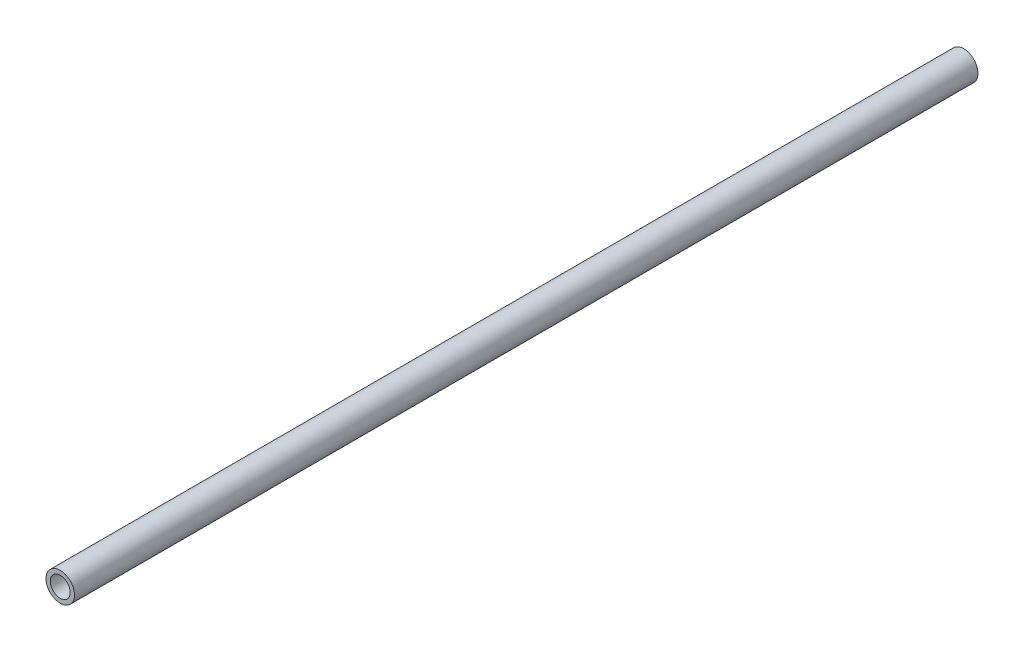
from build123d import *

# Parameters (mm, degrees)
SKETCH1_R           = 3.81
BOSS_EXTRUDE1_DEPTH = 241.3
SKETCH2_R           = 2.667
CUT_EXTRUDE1_DEPTH  = 242.360150398


with BuildPart() as part:
    # Sketch1 → Boss-Extrude1 (new body)
    with BuildSketch(Plane.XY):
        Circle(SKETCH1_R)
    extrude(amount=-BOSS_EXTRUDE1_DEPTH)

    # Sketch2 → Cut-Extrude1 (cut, through all)
    with BuildSketch(Plane.XY):
        Circle(SKETCH2_R)
    extrude(amount=-CUT_EXTRUDE1_DEPTH, mode=Mode.SUBTRACT)


solid = part.part
